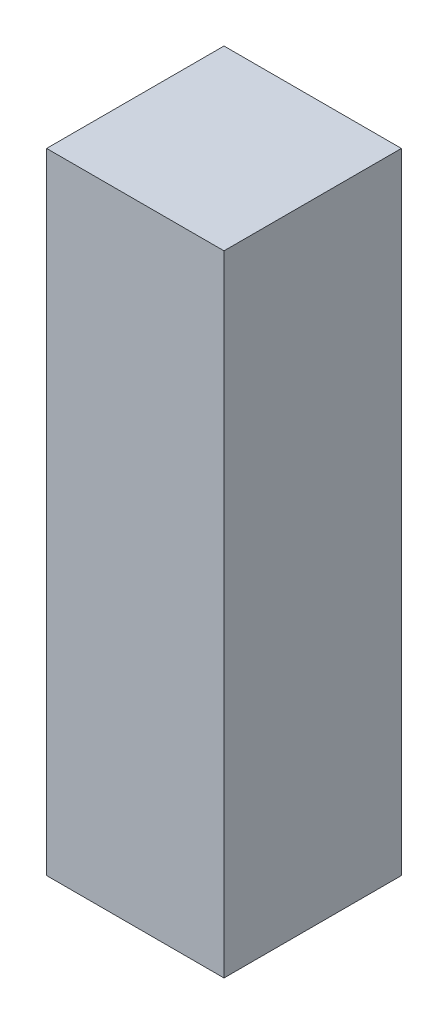
from build123d import *

# Parameters (mm, degrees)
SKETCH_1_W      = 5
SKETCH_1_H      = 5
EXTRUDE_1_DEPTH = 17.75


with BuildPart() as part:
    # 草图1 → 凸台-拉伸1 (new body)
    with BuildSketch(Plane(origin=(0, 0, 0), x_dir=(1, 0, 0), z_dir=(0, 1, 0))):
        with Locations((2.5, 2.5)):
            Rectangle(SKETCH_1_W, SKETCH_1_H)
    extrude(amount=EXTRUDE_1_DEPTH)


solid = part.part
